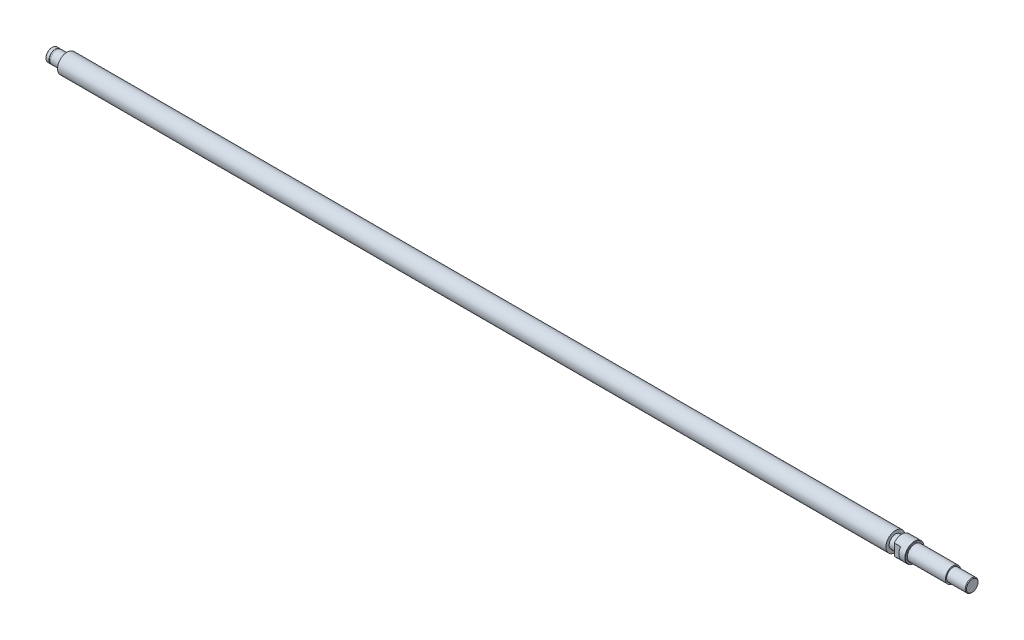
from build123d import *

# Parameters (mm, degrees)
FILLET1_R          = 0.3
CHAMFER1_SIZE      = 0.5
CHAMFER2_SIZE      = 0.2
CUT_EXTRUDE1_DEPTH = 5


with BuildPart() as part:
    # Sketch1 → Revolve1 (revolve)
    with BuildSketch(Plane.XY):
        Polygon((675, 7.5), (665, 7.5), (665, 5), (660, 5), (660, 7.5), (12, 7.5), (12, 5), (4, 5), (4, 4.8), (2.85, 4.8), (2.85, 5), (0, 5), (0, 0), (720, 0), (720, 5), (705, 5), (705, 6), (675, 6), align=None)
    revolve(axis=Axis((0, 0, 0), (1, 0, 0)))

    # Fillet1
    fillet1_edges = [part.edges().sort_by_distance(p)[0] for p in [
        (12, -5, 0),
        (675, -6, 0),
    ]]
    fillet(fillet1_edges, radius=FILLET1_R)

    # Chamfer1
    chamfer1_edges = [part.edges().sort_by_distance(p)[0] for p in [
        (720, -5, 0),
        (0, -5, 0),
    ]]
    chamfer(chamfer1_edges, length=CHAMFER1_SIZE)

    # Chamfer2
    chamfer2_edges = [part.edges().sort_by_distance(p)[0] for p in [
        (675, -7.5, 0),
    ]]
    chamfer(chamfer2_edges, length=CHAMFER2_SIZE)

    # Sketch2 → Cut-Extrude1 (cut)
    with BuildSketch(Plane.ZY.offset(-665)):
        with BuildLine():
            Line((-6, 4.5), (-6, -4.5))
            ThreePointArc((-6, -4.5), (-7.5, 0), (-6, 4.5))
        make_face()
        with BuildLine():
            Line((6, 4.5), (6, -4.5))
            ThreePointArc((6, -4.5), (7.5, 0), (6, 4.5))
        make_face()
    extrude(amount=-CUT_EXTRUDE1_DEPTH, mode=Mode.SUBTRACT)


solid = part.part
